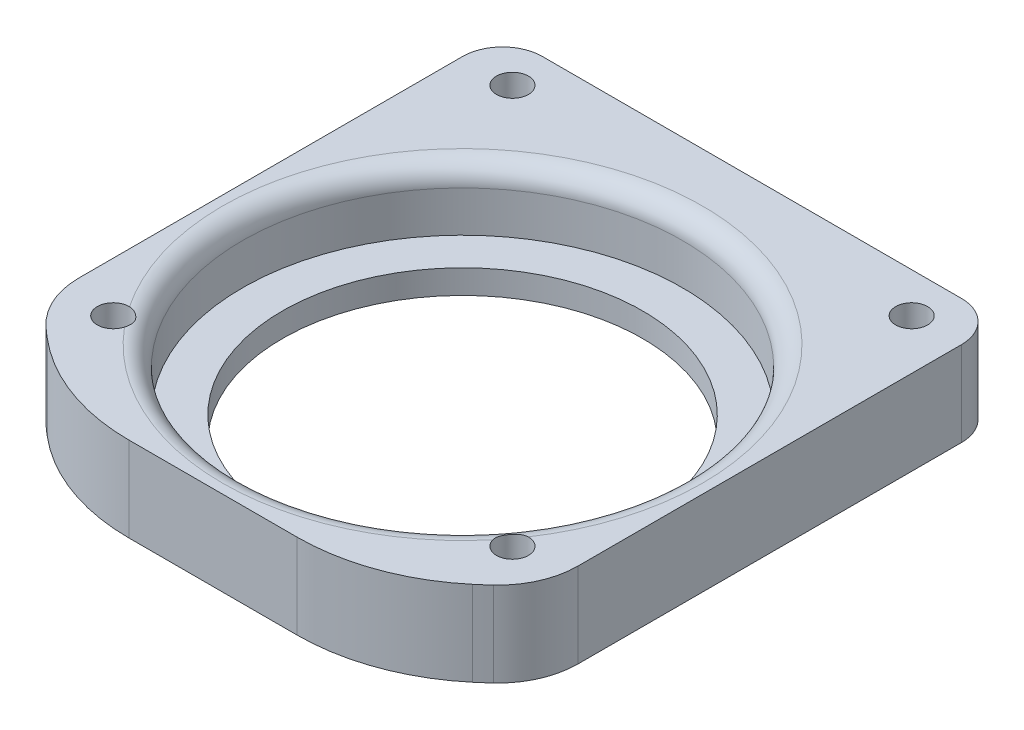
from build123d import *

# Parameters (mm, degrees)
SKETCH_1_R          = 25
EXTRUDE_1_DEPTH     = 8.5
SKETCH_2_R          = 22.05
CUT_EXTRUDE_1_DEPTH = 6.1
SKETCH_3_R          = 18.05
CUT_EXTRUDE_2_DEPTH = 12.5
FILLET_2_R          = 2
EXTRUDE_3_DEPTH     = 8.5
SKETCH_8_R          = 3.2
SKETCH_8_R_2        = 1.6
CUT_EXTRUDE_3_DEPTH = 2
SKETCH_8_2_R        = 1.6
CUT_EXTRUDE_4_DEPTH = 10
FILLET_3_R          = 4
CUT_EXTRUDE_5_DEPTH = 10
FILLET_5_R          = 8
FILLET_6_R          = 20


with BuildPart() as part:
    # 草图1 → 凸台-拉伸1 (new body)
    with BuildSketch(Plane(origin=(0, 0, 0), x_dir=(1, 0, 0), z_dir=(0, 1, 0))):
        Circle(SKETCH_1_R)
    extrude(amount=EXTRUDE_1_DEPTH)

    # 草图2 → 切除-拉伸1 (cut)
    with BuildSketch(Plane(origin=(0, 8.5, 0), x_dir=(1, 0, 0), z_dir=(0, 1, 0))):
        Circle(SKETCH_2_R)
    extrude(amount=-CUT_EXTRUDE_1_DEPTH, mode=Mode.SUBTRACT)

    # 草图3 → 切除-拉伸2 (cut)
    with BuildSketch(Plane(origin=(0, 2.4, 0), x_dir=(1, 0, 0), z_dir=(0, 1, 0))):
        Circle(SKETCH_3_R)
    extrude(amount=-CUT_EXTRUDE_2_DEPTH, mode=Mode.SUBTRACT)

    # 圆角2
    fillet_2_edges = [part.edges().sort_by_distance(p)[0] for p in [
        (-22.05, 8.5, 0),
    ]]
    fillet(fillet_2_edges, radius=FILLET_2_R)

    # 草图7 → 凸台-拉伸3 (add)
    with BuildSketch(Plane.XZ):
        with BuildLine():
            ThreePointArc((-25, -4.2e-08), (-17.677669545, 17.677669515), (0, 25))
            Line((0, 25), (-25, 25))
            Line((-25, 25), (-25, -4.2e-08))
        make_face()
        with BuildLine():
            Line((25, 25), (0, 25))
            ThreePointArc((0, 25), (17.67766953, 17.67766953), (25, 0))
            Line((25, 0), (25, 25))
        make_face()
        with BuildLine():
            ThreePointArc((25, 0), (2.1e-08, -25), (-25, -4.2e-08))
            Line((-25, -4.2e-08), (-25, -29))
            Line((-25, -29), (25, -29))
            Line((25, -29), (25, 0))
        make_face()
    extrude(amount=-EXTRUDE_3_DEPTH)

    # 草图8 → 切除-拉伸3 (cut)
    # profile 1 of 4: a face of its own
    with BuildSketch(Plane.XZ):
        with Locations((-20, 15)):
            Circle(SKETCH_8_R)
        with Locations((-20, 15)):
            Circle(SKETCH_8_R_2, mode=Mode.SUBTRACT)
    # profile 2 of 4: a face of its own
    with BuildSketch(Plane.XZ):
        with Locations((20, 15)):
            Circle(SKETCH_8_R)
        with Locations((20, 15)):
            Circle(SKETCH_8_R_2, mode=Mode.SUBTRACT)
    # profile 3 of 4: a face of its own
    with BuildSketch(Plane.XZ):
        with Locations((20, -25)):
            Circle(SKETCH_8_R)
        with Locations((20, -25)):
            Circle(SKETCH_8_R_2, mode=Mode.SUBTRACT)
    # profile 4 of 4: a face of its own
    with BuildSketch(Plane.XZ):
        with Locations((-20, -25)):
            Circle(SKETCH_8_R)
        with Locations((-20, -25)):
            Circle(SKETCH_8_R_2, mode=Mode.SUBTRACT)
    extrude(amount=-CUT_EXTRUDE_3_DEPTH, mode=Mode.SUBTRACT)

    # 草图8<2> → 切除-拉伸4 (cut)
    with BuildSketch(Plane.XZ):
        with Locations((-20, 15)):
            Circle(SKETCH_8_2_R)
        with Locations((20, 15)):
            Circle(SKETCH_8_2_R)
        with Locations((20, -25)):
            Circle(SKETCH_8_2_R)
        with Locations((-20, -25)):
            Circle(SKETCH_8_2_R)
    extrude(amount=-CUT_EXTRUDE_4_DEPTH, mode=Mode.SUBTRACT)

    # 圆角3
    fillet_3_edges = [part.edges().sort_by_distance(p)[0] for p in [
        (25, 4.25, -29),
        (-25, 4.25, -29),
    ]]
    fillet(fillet_3_edges, radius=FILLET_3_R)

    # 草图9 → 切除-拉伸5 (cut)
    with BuildSketch(Plane.XZ):
        with BuildLine():
            Line((25, 25), (13.928848582, 25))
            ThreePointArc((13.928848582, 25), (19.906442689, 21.414889027), (25, 16.656703877))
            Line((25, 16.656703877), (25, 25))
        make_face()
        with BuildLine():
            Line((-25, 25), (-25, 16.656703877))
            ThreePointArc((-25, 16.656703877), (-19.906442689, 21.414889027), (-13.928848582, 25))
            Line((-13.928848582, 25), (-25, 25))
        make_face()
    extrude(amount=-CUT_EXTRUDE_5_DEPTH, mode=Mode.SUBTRACT)

    # 圆角5
    fillet_5_edges = [part.edges().sort_by_distance(p)[0] for p in [
        (25, 4.25, 16.656703877),
        (-25, 4.25, 16.656703877),
    ]]
    fillet(fillet_5_edges, radius=FILLET_5_R)

    # 圆角6
    fillet_6_edges = [part.edges().sort_by_distance(p)[0] for p in [
        (13.928848582, 4.25, 25),
        (-13.928848582, 4.25, 25),
    ]]
    fillet(fillet_6_edges, radius=FILLET_6_R)


solid = part.part
